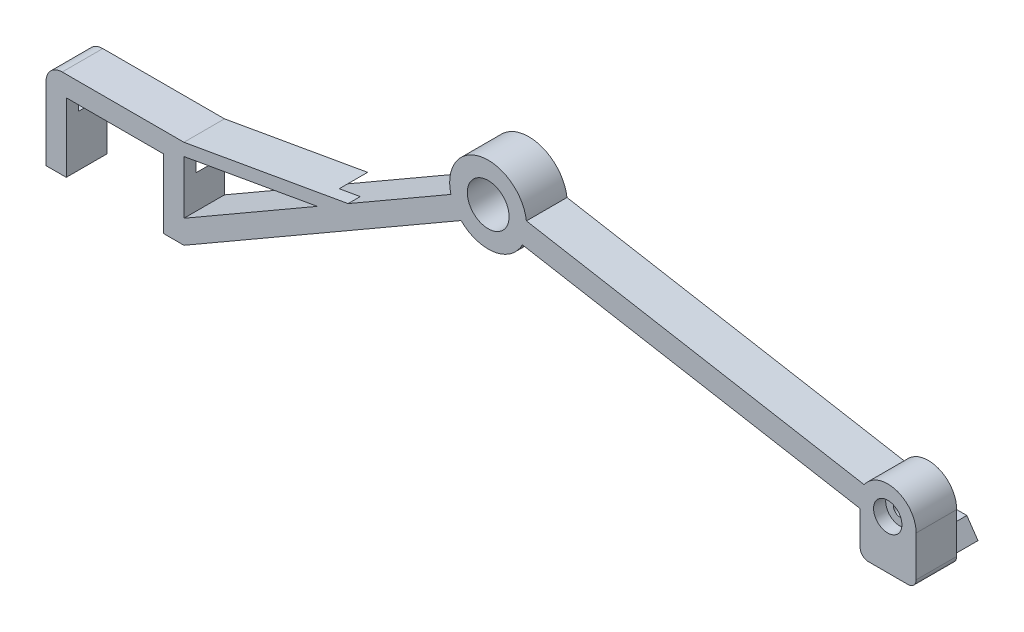
from build123d import *
from OCP.BRepFilletAPI import BRepFilletAPI_MakeFillet

# Parameters (mm, degrees)
SKETCH1_R           = 25.75
BOSS_EXTRUDE1_DEPTH = 25
SKETCH2_R           = 20.5
SKETCH2_R_2         = 8
BOSS_EXTRUDE2_DEPTH = 5
BOSS_EXTRUDE3_DEPTH = 50
SKETCH5_R           = 8
CUT_EXTRUDE1_DEPTH  = 1086.176840005
SKETCH6_R           = 17.5
CUT_EXTRUDE2_DEPTH  = 15
SKETCH7_W           = 8
SKETCH7_H           = 9
CUT_EXTRUDE3_DEPTH  = 35
BOSS_EXTRUDE4_DEPTH = 40
SKETCH9_R           = 6
CUT_EXTRUDE4_DEPTH  = 38.2
FILLET1_R1          = 20
FILLET1_R2          = 10


with BuildPart() as part:
    # Sketch1 → Boss-Extrude1 (new, symmetric)
    with BuildSketch(Plane.XY):
        with BuildLine():
            Line((0, 0), (-25, 0))
            Line((-25, 0), (-25, 110))
            Line((-25, 110), (145, 110))
            Line((145, 110), (145, 28.867513459))
            Line((145, 28.867513459), (474.063730334, 218.852546748))
            ThreePointArc((474.063730334, 218.852546748), (510.873444118, 277.555083571), (567.103024177, 237.06833037))
            Line((567.103024177, 237.06833037), (983.374527569, 163.668433022))
            ThreePointArc((983.374527569, 163.668433022), (1022.625735123, 177.590092488), (1047.403876506, 144.116018842))
            Line((1047.403876506, 144.116018842), (1047.403876506, 84.116018842))
            Line((1047.403876506, 84.116018842), (978.437892023, 84.116018842))
            Line((978.437892023, 84.116018842), (978.437892023, 135.671381603))
            Line((978.437892023, 135.671381603), (562.166388631, 209.071278951))
            ThreePointArc((562.166388631, 209.071278951), (527.367103522, 184.014892858), (486.563730334, 197.201911654))
            Line((486.563730334, 197.201911654), (145, 0))
            Line((145, 0), (120, 0))
            Line((120, 0), (120, 85))
            Line((120, 85), (0, 85))
            Line((0, 85), (0, 0))
        make_face()
        with Locations((520, 230.940107676)):
            Circle(SKETCH1_R, mode=Mode.SUBTRACT)
    extrude(amount=BOSS_EXTRUDE1_DEPTH, both=True)

    # Sketch2 → Boss-Extrude2 (add)
    with BuildSketch(Plane.XY.offset(-25)):
        with Locations((1012.403876506, 144.116018842)):
            Circle(SKETCH2_R)
        with Locations((1012.403876506, 144.116018842)):
            Circle(SKETCH2_R_2, mode=Mode.SUBTRACT)
    extrude(amount=-BOSS_EXTRUDE2_DEPTH)

    # Sketch4 → Boss-Extrude3 (add)
    with BuildSketch(Plane.XY.offset(25)):
        Polygon((145, 110), (347.313653274, 145.673355638), (309.33231998, 123.744822637), (145, 94.768600822), align=None)
    extrude(amount=-BOSS_EXTRUDE3_DEPTH)

    # Sketch5 → Cut-Extrude1 (cut, through all)
    with BuildSketch(Plane.XY.offset(25)):
        with Locations((1012.403876506, 144.116018842)):
            Circle(SKETCH5_R)
    extrude(amount=-CUT_EXTRUDE1_DEPTH, mode=Mode.SUBTRACT)

    # Sketch6 → Cut-Extrude2 (cut)
    with BuildSketch(Plane(origin=(0, 0, 25), x_dir=(-1, 0, 0), z_dir=(0, 0, -1))):
        with Locations((-1012.403876506, 144.116018842)):
            Circle(SKETCH6_R)
    extrude(amount=CUT_EXTRUDE2_DEPTH, mode=Mode.SUBTRACT)

    # Sketch7 → Cut-Extrude3 (cut)
    with BuildSketch(Plane.XY.offset(-25)):
        Polygon((120, 85), (145, 85), (145, 70), (120, 45), align=None)
        Polygon((347.313653274, 145.673355638), (309.33231998, 123.744822637), (283.417852806, 119.175402883), (321.3991861, 141.103935884), align=None)
        with Locations((-4, 67.5)):
            Rectangle(SKETCH7_W, SKETCH7_H)
    extrude(amount=CUT_EXTRUDE3_DEPTH, mode=Mode.SUBTRACT)

    # Sketch8 → Boss-Extrude4 (add)
    with BuildSketch(Plane.XY.offset(-25)):
        Polygon((991.153876506, 84.116018842), (1033.653876506, 84.116018842), (1019.903876506, 104.116018842), (1004.903876506, 104.116018842), align=None)
    extrude(amount=-BOSS_EXTRUDE4_DEPTH)

    # Sketch9 → Cut-Extrude4 (cut)
    with BuildSketch(Plane.XZ):
        with Locations((-7.475, 0)):
            Circle(SKETCH9_R)
        with Locations((127.475, 0)):
            Circle(SKETCH9_R)
    extrude(amount=-CUT_EXTRUDE4_DEPTH, mode=Mode.SUBTRACT)

    # Fillet1: one fillet with a radius per group of edges: ONE call of the kernel's fillet builder (fillet() takes one radius for all edges)
    fillet1_edges_1 = [part.edges().sort_by_distance(p)[0] for p in [
        (-25, 110, 0),
    ]]
    fillet1_edges_2 = [part.edges().sort_by_distance(p)[0] for p in [
        (1047.403876506, 84.116018842, 0),
        (978.437892023, 84.116018842, 0),
    ]]
    fillet1 = BRepFilletAPI_MakeFillet(part.part.solid().wrapped)
    for e in fillet1_edges_1:
        fillet1.Add(FILLET1_R1, e.wrapped)
    for e in fillet1_edges_2:
        fillet1.Add(FILLET1_R2, e.wrapped)
    add(Compound.cast(fillet1.Shape()), mode=Mode.REPLACE)


solid = part.part
